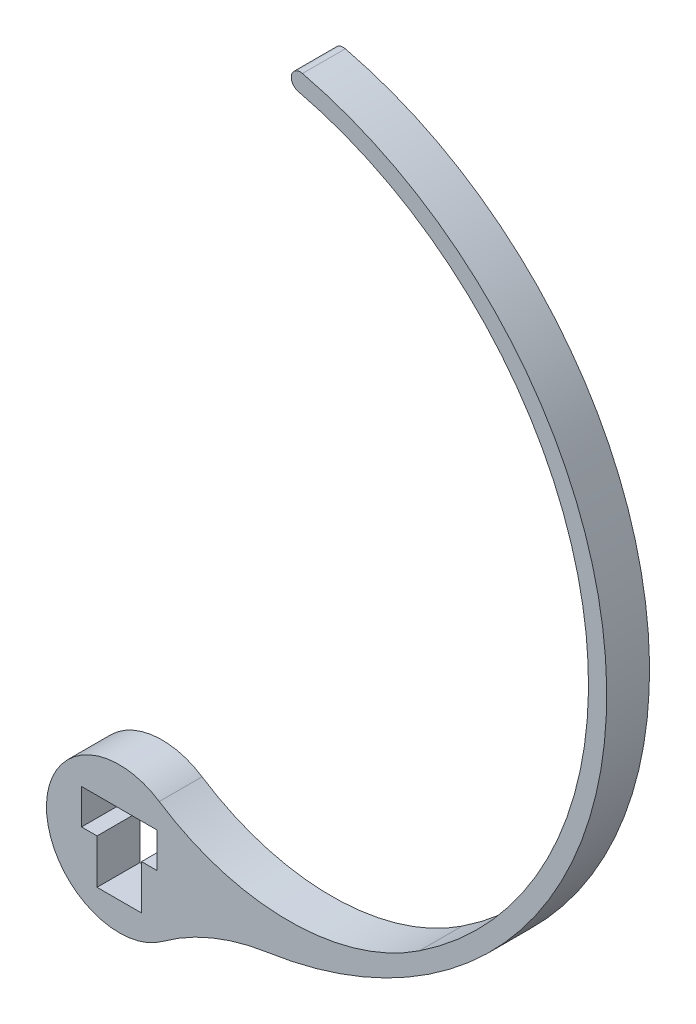
from build123d import *

# Parameters (mm, degrees)
BOSS_EXTRUDE2_DEPTH = 6.35
FILLET1_R           = 35
CUT_EXTRUDE1_DEPTH  = 135.431204491


with BuildPart() as part:
    # Sketch1 → Boss-Extrude2 (new body)
    with BuildSketch(Plane.XY):
        with BuildLine():
            ThreePointArc((10.798543624, -0.177357298), (-10.690836494, 1.531670676), (10.413952601, -2.861746185))
            ThreePointArc((10.413952601, -2.861746185), (71.669169509, 47.501819321), (27.161368085, 113.135240238))
            ThreePointArc((27.161368085, 113.135240238), (25.533517451, 112.137692087), (26.531065602, 110.509841453))
            ThreePointArc((26.531065602, 110.509841453), (69.014379057, 48.009806686), (10.798543624, -0.177357298))
        make_face()
    extrude(amount=BOSS_EXTRUDE2_DEPTH)

    # Fillet1
    fillet1_edges = [part.edges().sort_by_distance(p)[0] for p in [
        (10.413952601, -2.861746185, 3.175),
        (10.798543624, -0.177357298, 3.175),
    ]]
    fillet(fillet1_edges, radius=FILLET1_R)

    # Sketch2 → Cut-Extrude1 (cut, through all)
    with BuildSketch(Plane.XY.offset(6.35)):
        Polygon((-5.6, 0), (-3.3, 0), (-3.3, -6.6), (3.3, -6.6), (3.3, 0), (5.6, 0), (5.6, 5.2), (-5.6, 5.2), align=None)
    extrude(amount=-CUT_EXTRUDE1_DEPTH, mode=Mode.SUBTRACT)


solid = part.part
